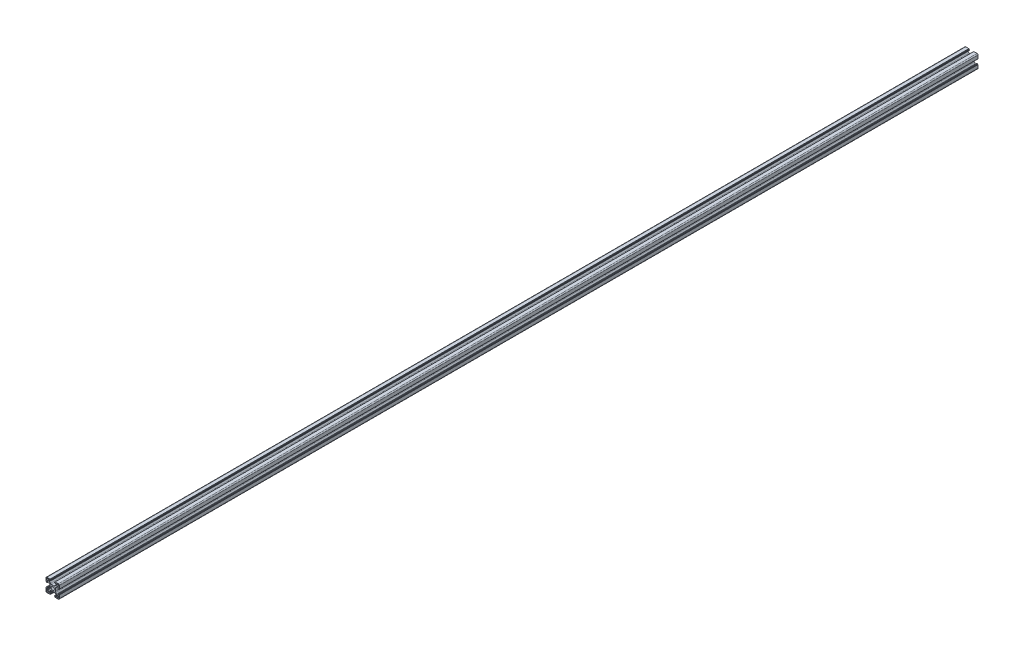
from build123d import *

# Parameters (mm, degrees)
EXTRUDE_1_DEPTH = 1380


with BuildPart() as part:
    # Эскиз1 → Бобышка-Вытянуть1 (new body)
    with BuildSketch(Plane.XY):
        with BuildLine():
            Line((-34.993325654, 64.172801362), (-33.094544985, 64.172801362))
            ThreePointArc((-33.094544985, 64.172801362), (-32.32917812, 64.325042297), (-31.680331423, 64.758587799))
            Line((-31.680331423, 64.758587799), (-30.379112092, 66.05980713))
            ThreePointArc((-30.379112092, 66.05980713), (-29.945566589, 66.708653828), (-29.793325654, 67.474020692))
            Line((-29.793325654, 67.474020692), (-29.793325654, 68.372801362))
            ThreePointArc((-29.793325654, 68.372801362), (-29.939772264, 68.726354752), (-30.293325654, 68.872801362))
            Line((-30.293325654, 68.872801362), (-30.396218873, 68.872801362))
            ThreePointArc((-30.396218873, 68.872801362), (-30.587560589, 68.834741128), (-30.749772264, 68.726354752))
            Line((-30.749772264, 68.726354752), (-31.23010235, 68.246024666))
            ThreePointArc((-31.23010235, 68.246024666), (-31.311208187, 68.191831478), (-31.406879045, 68.172801362))
            Line((-31.406879045, 68.172801362), (-31.693325654, 68.172801362))
            ThreePointArc((-31.693325654, 68.172801362), (-31.87010235, 68.246024666), (-31.943325654, 68.422801362))
            Line((-31.943325654, 68.422801362), (-31.943325654, 69.571872182))
            ThreePointArc((-31.943325654, 69.571872182), (-31.899391671, 69.677938199), (-31.793325654, 69.721872182))
            Line((-31.793325654, 69.721872182), (-31.293325654, 69.721872182))
            Line((-31.293325654, 69.721872182), (-31.293325654, 70.022801362))
            ThreePointArc((-31.293325654, 70.022801362), (-31.249391671, 70.128867379), (-31.143325654, 70.172801362))
            Line((-31.143325654, 70.172801362), (-26.493325654, 70.172801362))
            ThreePointArc((-26.493325654, 70.172801362), (-25.432665483, 69.733461533), (-24.993325654, 68.672801362))
            Line((-24.993325654, 68.672801362), (-24.993325654, 64.022801362))
            ThreePointArc((-24.993325654, 64.022801362), (-25.037259637, 63.916735344), (-25.143325654, 63.872801362))
            Line((-25.143325654, 63.872801362), (-25.444254834, 63.872801362))
            Line((-25.444254834, 63.872801362), (-25.444254834, 63.372801362))
            ThreePointArc((-25.444254834, 63.372801362), (-25.488188817, 63.266735344), (-25.594254834, 63.222801362))
            Line((-25.594254834, 63.222801362), (-26.743325654, 63.222801362))
            ThreePointArc((-26.743325654, 63.222801362), (-26.92010235, 63.296024666), (-26.993325654, 63.472801362))
            Line((-26.993325654, 63.472801362), (-26.993325654, 63.759247971))
            ThreePointArc((-26.993325654, 63.759247971), (-26.974295537, 63.854918829), (-26.92010235, 63.936024666))
            Line((-26.92010235, 63.936024666), (-26.439772264, 64.416354752))
            ThreePointArc((-26.439772264, 64.416354752), (-26.331385888, 64.578566427), (-26.293325654, 64.769908143))
            Line((-26.293325654, 64.769908143), (-26.293325654, 64.872801362))
            ThreePointArc((-26.293325654, 64.872801362), (-26.439772264, 65.226354752), (-26.793325654, 65.372801362))
            Line((-26.793325654, 65.372801362), (-27.692106323, 65.372801362))
            ThreePointArc((-27.692106323, 65.372801362), (-28.457473188, 65.220560427), (-29.106319886, 64.787014924))
            Line((-29.106319886, 64.787014924), (-30.407539217, 63.485795593))
            ThreePointArc((-30.407539217, 63.485795593), (-30.841084719, 62.836948895), (-30.993325654, 62.071582031))
            Line((-30.993325654, 62.071582031), (-30.993325654, 60.172801362))
            Line((-30.993325654, 60.172801362), (-30.993325654, 58.274020692))
            ThreePointArc((-30.993325654, 58.274020692), (-30.841084719, 57.508653828), (-30.407539217, 56.85980713))
            Line((-30.407539217, 56.85980713), (-29.106319886, 55.558587799))
            ThreePointArc((-29.106319886, 55.558587799), (-28.457473188, 55.125042297), (-27.692106323, 54.972801362))
            Line((-27.692106323, 54.972801362), (-26.793325654, 54.972801362))
            ThreePointArc((-26.793325654, 54.972801362), (-26.439772264, 55.119247971), (-26.293325654, 55.472801362))
            Line((-26.293325654, 55.472801362), (-26.293325654, 55.57569458))
            ThreePointArc((-26.293325654, 55.57569458), (-26.331385888, 55.767036297), (-26.439772264, 55.929247971))
            Line((-26.439772264, 55.929247971), (-26.92010235, 56.409578057))
            ThreePointArc((-26.92010235, 56.409578057), (-26.974295537, 56.490683894), (-26.993325654, 56.586354752))
            Line((-26.993325654, 56.586354752), (-26.993325654, 56.872801362))
            ThreePointArc((-26.993325654, 56.872801362), (-26.92010235, 57.049578057), (-26.743325654, 57.122801362))
            Line((-26.743325654, 57.122801362), (-25.594254834, 57.122801362))
            ThreePointArc((-25.594254834, 57.122801362), (-25.488188817, 57.078867379), (-25.444254834, 56.972801362))
            Line((-25.444254834, 56.972801362), (-25.444254834, 56.472801362))
            Line((-25.444254834, 56.472801362), (-25.143325654, 56.472801362))
            ThreePointArc((-25.143325654, 56.472801362), (-25.037259637, 56.428867379), (-24.993325654, 56.322801362))
            Line((-24.993325654, 56.322801362), (-24.993325654, 51.672801362))
            ThreePointArc((-24.993325654, 51.672801362), (-25.432665483, 50.61214119), (-26.493325654, 50.172801362))
            Line((-26.493325654, 50.172801362), (-31.143325654, 50.172801362))
            ThreePointArc((-31.143325654, 50.172801362), (-31.249391671, 50.216735344), (-31.293325654, 50.322801362))
            Line((-31.293325654, 50.322801362), (-31.293325654, 50.623730541))
            Line((-31.293325654, 50.623730541), (-31.793325654, 50.623730541))
            ThreePointArc((-31.793325654, 50.623730541), (-31.899391671, 50.667664524), (-31.943325654, 50.773730541))
            Line((-31.943325654, 50.773730541), (-31.943325654, 51.922801362))
            ThreePointArc((-31.943325654, 51.922801362), (-31.87010235, 52.099578057), (-31.693325654, 52.172801362))
            Line((-31.693325654, 52.172801362), (-31.406879045, 52.172801362))
            ThreePointArc((-31.406879045, 52.172801362), (-31.311208187, 52.153771245), (-31.23010235, 52.099578057))
            Line((-31.23010235, 52.099578057), (-30.749772264, 51.619247971))
            ThreePointArc((-30.749772264, 51.619247971), (-30.587560589, 51.510861595), (-30.396218873, 51.472801362))
            Line((-30.396218873, 51.472801362), (-30.293325654, 51.472801362))
            ThreePointArc((-30.293325654, 51.472801362), (-29.939772264, 51.619247971), (-29.793325654, 51.972801362))
            Line((-29.793325654, 51.972801362), (-29.793325654, 52.871582031))
            ThreePointArc((-29.793325654, 52.871582031), (-29.945566589, 53.636948895), (-30.379112092, 54.285795593))
            Line((-30.379112092, 54.285795593), (-31.680331423, 55.587014924))
            ThreePointArc((-31.680331423, 55.587014924), (-32.32917812, 56.020560427), (-33.094544985, 56.172801362))
            Line((-33.094544985, 56.172801362), (-34.993325654, 56.172801362))
            Line((-34.993325654, 56.172801362), (-36.892106323, 56.172801362))
            ThreePointArc((-36.892106323, 56.172801362), (-37.657473188, 56.020560427), (-38.306319886, 55.587014924))
            Line((-38.306319886, 55.587014924), (-39.607539217, 54.285795593))
            ThreePointArc((-39.607539217, 54.285795593), (-40.041084719, 53.636948895), (-40.193325654, 52.871582031))
            Line((-40.193325654, 52.871582031), (-40.193325654, 51.972801362))
            ThreePointArc((-40.193325654, 51.972801362), (-40.046879045, 51.619247971), (-39.693325654, 51.472801362))
            Line((-39.693325654, 51.472801362), (-39.590432436, 51.472801362))
            ThreePointArc((-39.590432436, 51.472801362), (-39.399090719, 51.510861595), (-39.236879045, 51.619247971))
            Line((-39.236879045, 51.619247971), (-38.756548959, 52.099578057))
            ThreePointArc((-38.756548959, 52.099578057), (-38.675443122, 52.153771245), (-38.579772264, 52.172801362))
            Line((-38.579772264, 52.172801362), (-38.293325654, 52.172801362))
            ThreePointArc((-38.293325654, 52.172801362), (-38.116548959, 52.099578057), (-38.043325654, 51.922801362))
            Line((-38.043325654, 51.922801362), (-38.043325654, 50.773730541))
            ThreePointArc((-38.043325654, 50.773730541), (-38.087259637, 50.667664524), (-38.193325654, 50.623730541))
            Line((-38.193325654, 50.623730541), (-38.693325654, 50.623730541))
            Line((-38.693325654, 50.623730541), (-38.693325654, 50.322801362))
            ThreePointArc((-38.693325654, 50.322801362), (-38.737259637, 50.216735344), (-38.843325654, 50.172801362))
            Line((-38.843325654, 50.172801362), (-43.493325654, 50.172801362))
            ThreePointArc((-43.493325654, 50.172801362), (-44.553985826, 50.61214119), (-44.993325654, 51.672801362))
            Line((-44.993325654, 51.672801362), (-44.993325654, 56.322801362))
            ThreePointArc((-44.993325654, 56.322801362), (-44.949391671, 56.428867379), (-44.843325654, 56.472801362))
            Line((-44.843325654, 56.472801362), (-44.542396475, 56.472801362))
            Line((-44.542396475, 56.472801362), (-44.542396475, 56.972801362))
            ThreePointArc((-44.542396475, 56.972801362), (-44.498462492, 57.078867379), (-44.392396475, 57.122801362))
            Line((-44.392396475, 57.122801362), (-43.243325654, 57.122801362))
            ThreePointArc((-43.243325654, 57.122801362), (-43.066548959, 57.049578057), (-42.993325654, 56.872801362))
            Line((-42.993325654, 56.872801362), (-42.993325654, 56.586354752))
            ThreePointArc((-42.993325654, 56.586354752), (-43.012355771, 56.490683894), (-43.066548959, 56.409578057))
            Line((-43.066548959, 56.409578057), (-43.546879045, 55.929247971))
            ThreePointArc((-43.546879045, 55.929247971), (-43.655265421, 55.767036297), (-43.693325654, 55.57569458))
            Line((-43.693325654, 55.57569458), (-43.693325654, 55.472801362))
            ThreePointArc((-43.693325654, 55.472801362), (-43.546879045, 55.119247971), (-43.193325654, 54.972801362))
            Line((-43.193325654, 54.972801362), (-42.294544985, 54.972801362))
            ThreePointArc((-42.294544985, 54.972801362), (-41.52917812, 55.125042297), (-40.880331423, 55.558587799))
            Line((-40.880331423, 55.558587799), (-39.579112092, 56.85980713))
            ThreePointArc((-39.579112092, 56.85980713), (-39.145566589, 57.508653828), (-38.993325654, 58.274020692))
            Line((-38.993325654, 58.274020692), (-38.993325654, 60.172801362))
            Line((-38.993325654, 60.172801362), (-38.993325654, 62.071582031))
            ThreePointArc((-38.993325654, 62.071582031), (-39.145566589, 62.836948895), (-39.579112092, 63.485795593))
            Line((-39.579112092, 63.485795593), (-40.880331423, 64.787014924))
            ThreePointArc((-40.880331423, 64.787014924), (-41.52917812, 65.220560427), (-42.294544985, 65.372801362))
            Line((-42.294544985, 65.372801362), (-43.193325654, 65.372801362))
            ThreePointArc((-43.193325654, 65.372801362), (-43.546879045, 65.226354752), (-43.693325654, 64.872801362))
            Line((-43.693325654, 64.872801362), (-43.693325654, 64.769908143))
            ThreePointArc((-43.693325654, 64.769908143), (-43.655265421, 64.578566427), (-43.546879045, 64.416354752))
            Line((-43.546879045, 64.416354752), (-43.066548959, 63.936024666))
            ThreePointArc((-43.066548959, 63.936024666), (-43.012355771, 63.854918829), (-42.993325654, 63.759247971))
            Line((-42.993325654, 63.759247971), (-42.993325654, 63.472801362))
            ThreePointArc((-42.993325654, 63.472801362), (-43.066548959, 63.296024666), (-43.243325654, 63.222801362))
            Line((-43.243325654, 63.222801362), (-44.392396475, 63.222801362))
            ThreePointArc((-44.392396475, 63.222801362), (-44.498462492, 63.266735344), (-44.542396475, 63.372801362))
            Line((-44.542396475, 63.372801362), (-44.542396475, 63.872801362))
            Line((-44.542396475, 63.872801362), (-44.843325654, 63.872801362))
            ThreePointArc((-44.843325654, 63.872801362), (-44.949391671, 63.916735344), (-44.993325654, 64.022801362))
            Line((-44.993325654, 64.022801362), (-44.993325654, 68.672801362))
            ThreePointArc((-44.993325654, 68.672801362), (-44.553985826, 69.733461533), (-43.493325654, 70.172801362))
            Line((-43.493325654, 70.172801362), (-38.843325654, 70.172801362))
            ThreePointArc((-38.843325654, 70.172801362), (-38.737259637, 70.128867379), (-38.693325654, 70.022801362))
            Line((-38.693325654, 70.022801362), (-38.693325654, 69.721872182))
            Line((-38.693325654, 69.721872182), (-38.193325654, 69.721872182))
            ThreePointArc((-38.193325654, 69.721872182), (-38.087259637, 69.677938199), (-38.043325654, 69.571872182))
            Line((-38.043325654, 69.571872182), (-38.043325654, 68.422801362))
            ThreePointArc((-38.043325654, 68.422801362), (-38.116548959, 68.246024666), (-38.293325654, 68.172801362))
            Line((-38.293325654, 68.172801362), (-38.579772264, 68.172801362))
            ThreePointArc((-38.579772264, 68.172801362), (-38.675443122, 68.191831478), (-38.756548959, 68.246024666))
            Line((-38.756548959, 68.246024666), (-39.236879045, 68.726354752))
            ThreePointArc((-39.236879045, 68.726354752), (-39.399090719, 68.834741128), (-39.590432436, 68.872801362))
            Line((-39.590432436, 68.872801362), (-39.693325654, 68.872801362))
            ThreePointArc((-39.693325654, 68.872801362), (-40.046879045, 68.726354752), (-40.193325654, 68.372801362))
            Line((-40.193325654, 68.372801362), (-40.193325654, 67.474020692))
            ThreePointArc((-40.193325654, 67.474020692), (-40.041084719, 66.708653828), (-39.607539217, 66.05980713))
            Line((-39.607539217, 66.05980713), (-38.306319886, 64.758587799))
            ThreePointArc((-38.306319886, 64.758587799), (-37.657473188, 64.325042297), (-36.892106323, 64.172801362))
            Line((-36.892106323, 64.172801362), (-34.993325654, 64.172801362))
        make_face()
        with BuildLine():
            Line((-28.093325654, 66.272801362), (-26.693325654, 66.272801362))
            ThreePointArc((-26.693325654, 66.272801362), (-26.127640229, 66.507115937), (-25.893325654, 67.072801362))
            Line((-25.893325654, 67.072801362), (-25.893325654, 68.472801362))
            ThreePointArc((-25.893325654, 68.472801362), (-26.127640229, 69.038486787), (-26.693325654, 69.272801362))
            Line((-26.693325654, 69.272801362), (-28.093325654, 69.272801362))
            ThreePointArc((-28.093325654, 69.272801362), (-28.659011079, 69.038486787), (-28.893325654, 68.472801362))
            Line((-28.893325654, 68.472801362), (-28.893325654, 67.072801362))
            ThreePointArc((-28.893325654, 67.072801362), (-28.659011079, 66.507115937), (-28.093325654, 66.272801362))
        make_face(mode=Mode.SUBTRACT)
        with BuildLine():
            Line((-28.893325654, 53.272801362), (-28.893325654, 51.872801362))
            ThreePointArc((-28.893325654, 51.872801362), (-28.659011079, 51.307115937), (-28.093325654, 51.072801362))
            Line((-28.093325654, 51.072801362), (-26.693325654, 51.072801362))
            ThreePointArc((-26.693325654, 51.072801362), (-26.127640229, 51.307115937), (-25.893325654, 51.872801362))
            Line((-25.893325654, 51.872801362), (-25.893325654, 53.272801362))
            ThreePointArc((-25.893325654, 53.272801362), (-26.127640229, 53.838486787), (-26.693325654, 54.072801362))
            Line((-26.693325654, 54.072801362), (-28.093325654, 54.072801362))
            ThreePointArc((-28.093325654, 54.072801362), (-28.659011079, 53.838486787), (-28.893325654, 53.272801362))
        make_face(mode=Mode.SUBTRACT)
        with BuildLine():
            Line((-41.893325654, 54.072801362), (-43.293325654, 54.072801362))
            ThreePointArc((-43.293325654, 54.072801362), (-43.859011079, 53.838486787), (-44.093325654, 53.272801362))
            Line((-44.093325654, 53.272801362), (-44.093325654, 51.872801362))
            ThreePointArc((-44.093325654, 51.872801362), (-43.859011079, 51.307115937), (-43.293325654, 51.072801362))
            Line((-43.293325654, 51.072801362), (-41.893325654, 51.072801362))
            ThreePointArc((-41.893325654, 51.072801362), (-41.327640229, 51.307115937), (-41.093325654, 51.872801362))
            Line((-41.093325654, 51.872801362), (-41.093325654, 53.272801362))
            ThreePointArc((-41.093325654, 53.272801362), (-41.327640229, 53.838486787), (-41.893325654, 54.072801362))
        make_face(mode=Mode.SUBTRACT)
        with BuildLine():
            Line((-41.093325654, 67.072801362), (-41.093325654, 68.472801362))
            ThreePointArc((-41.093325654, 68.472801362), (-41.327640229, 69.038486787), (-41.893325654, 69.272801362))
            Line((-41.893325654, 69.272801362), (-43.293325654, 69.272801362))
            ThreePointArc((-43.293325654, 69.272801362), (-43.859011079, 69.038486787), (-44.093325654, 68.472801362))
            Line((-44.093325654, 68.472801362), (-44.093325654, 67.072801362))
            ThreePointArc((-44.093325654, 67.072801362), (-43.859011079, 66.507115937), (-43.293325654, 66.272801362))
            Line((-43.293325654, 66.272801362), (-41.893325654, 66.272801362))
            ThreePointArc((-41.893325654, 66.272801362), (-41.327640229, 66.507115937), (-41.093325654, 67.072801362))
        make_face(mode=Mode.SUBTRACT)
        with BuildLine():
            ThreePointArc((-32.493325654, 60.172801362), (-33.225558701, 61.940568315), (-34.993325654, 62.672801362))
            ThreePointArc((-34.993325654, 62.672801362), (-36.761092607, 61.940568315), (-37.493325654, 60.172801362))
            ThreePointArc((-37.493325654, 60.172801362), (-36.761092607, 58.405034409), (-34.993325654, 57.672801362))
            ThreePointArc((-34.993325654, 57.672801362), (-33.225558701, 58.405034409), (-32.493325654, 60.172801362))
        make_face(mode=Mode.SUBTRACT)
    extrude(amount=EXTRUDE_1_DEPTH)


solid = part.part
